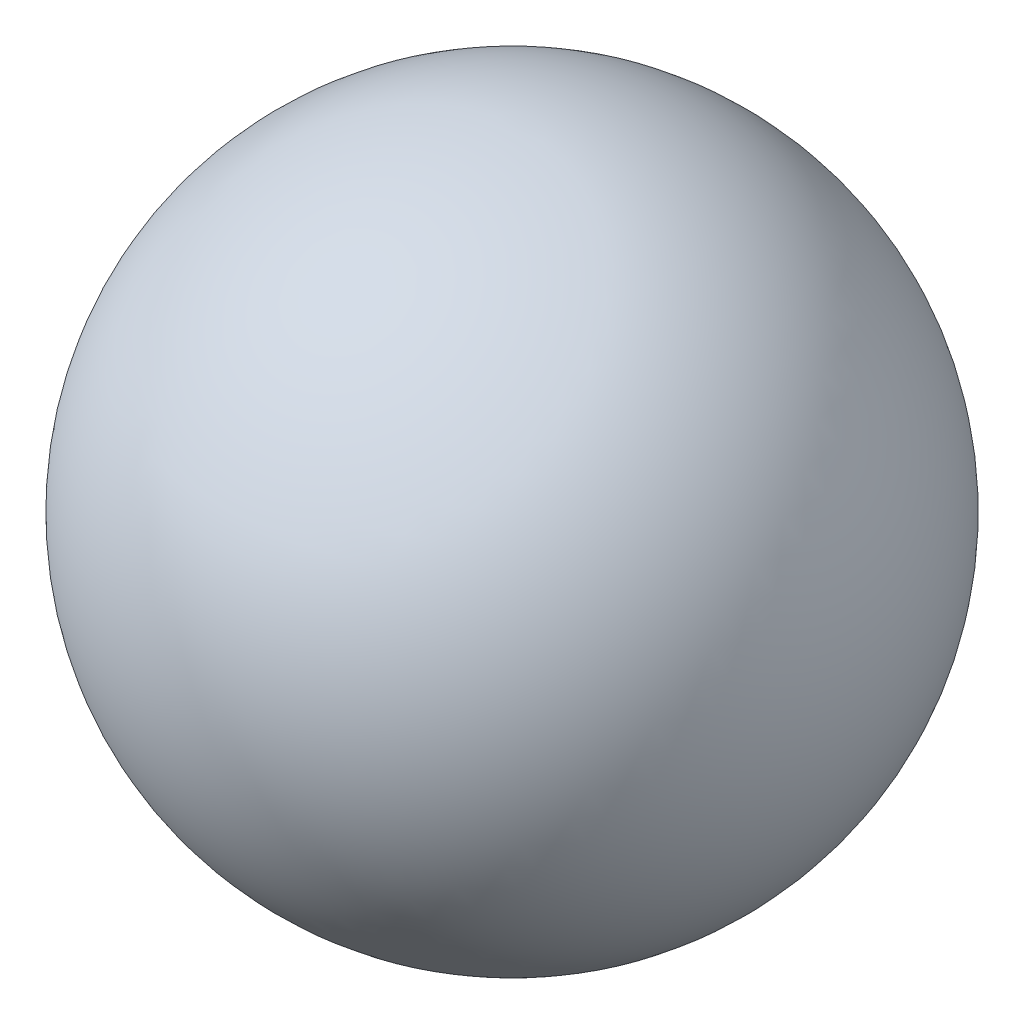
from build123d import *
from build123d.topology import SkipClean


with BuildPart() as part:
    # 草图1 → 旋转1 (revolve)
    with SkipClean():  # the faces are left unmerged after this step: merging them gives an invalid solid
        with BuildSketch(Plane.XY):
            with BuildLine():
                ThreePointArc((90, 0), (63.639610307, 63.639610307), (0, 90))
                Line((0, 90), (0, -90))
                ThreePointArc((0, -90), (63.639610307, -63.639610307), (90, 0))
            make_face()
            with BuildLine():
                Line((0, -90), (0, 90))
                ThreePointArc((0, 90), (-90, 0), (0, -90))
            make_face()
        revolve(axis=Axis((0, 90, 0), (0, -1, 0)))


solid = part.part
